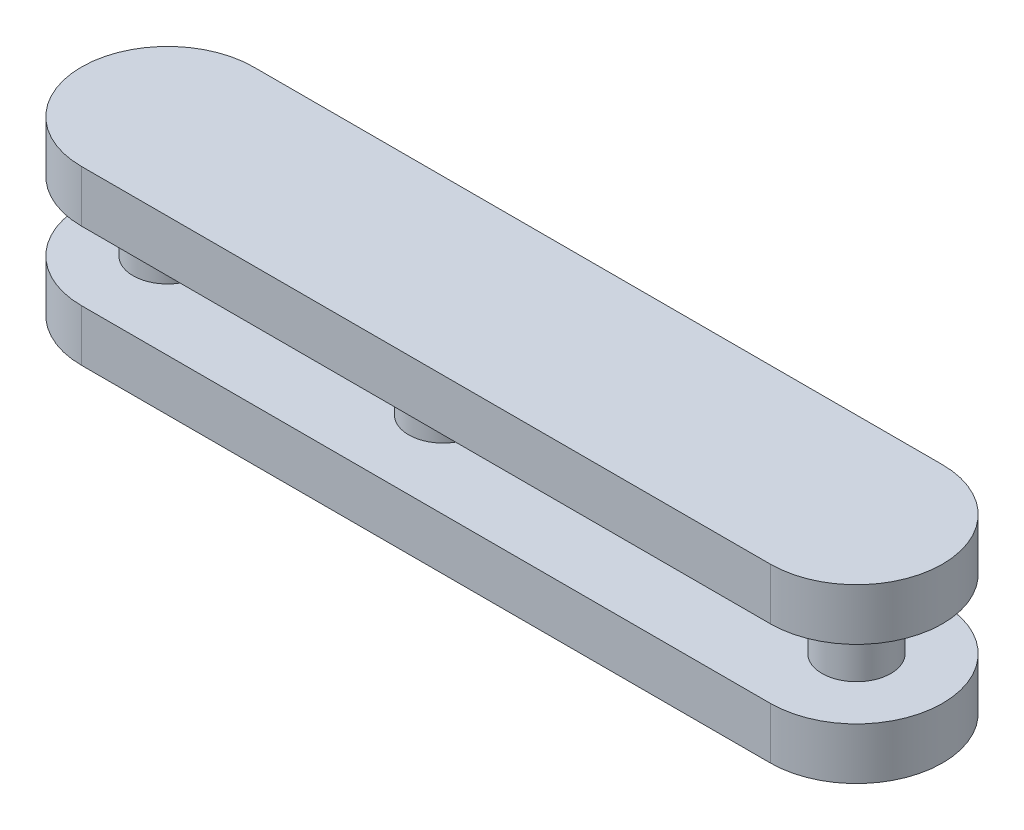
from build123d import *

# Parameters (mm, degrees)
ESQUISSE1_W             = 50
ESQUISSE1_H             = 10
BOSS_EXTRU_1_DEPTH      = 10
ENL_V_MAT_EXTRU_1_DEPTH = 10
ESQUISSE3_R             = 2
BOSS_EXTRU_2_DEPTH      = 5
ENL_V_MAT_EXTRU_2_DEPTH = 52.961524227
ESQUISSE6_R             = 2
BOSS_EXTRU_3_DEPTH      = 5


with BuildPart() as part:
    # Esquisse1 → Boss.-Extru.1 (new body)
    with BuildSketch(Plane(origin=(0, 0, 0), x_dir=(1, 0, 0), z_dir=(0, 1, 0))):
        with Locations((25, 5)):
            Rectangle(ESQUISSE1_W, ESQUISSE1_H)
    extrude(amount=BOSS_EXTRU_1_DEPTH)

    # Esquisse2 → Enlèv. mat.-Extru.1 (cut)
    with BuildSketch(Plane.XY):
        Polygon((0, 3), (20, 3), (30, 3), (50, 3), (50, 7), (30, 7), (20, 7), (0, 7), align=None)
    extrude(amount=-ENL_V_MAT_EXTRU_1_DEPTH, mode=Mode.SUBTRACT)


with BuildPart() as enl_v_mat_extru_1_piece_1:
    # of the separate pieces the step leaves, piece 1, a body of its own (enl_v_mat_extru_1_pieces)
    add(part.part.solids().sort_by_distance((0, 7, 0))[0])

    # Esquisse3 → Boss.-Extru.2 (add)
    with BuildSketch(Plane(origin=(0, 3, 0), x_dir=(1, 0, 0), z_dir=(0, 1, 0))):
        with Locations(Location((5, 5, 0), (0, 0, 270))):
            Circle(ESQUISSE3_R)
        with Locations(Location((45, 5, 0), (0, 0, 270))):
            Circle(ESQUISSE3_R)
    extrude(amount=BOSS_EXTRU_2_DEPTH)


with BuildPart() as enl_v_mat_extru_1_piece_2:
    # of the separate pieces the step leaves, piece 2, a body of its own (enl_v_mat_extru_1_pieces)
    add(part.part.solids().sort_by_distance((0, 0, 0))[0])


with BuildPart() as enl_v_mat_extru_2_tool:
    # Esquisse4 → Enlèv. mat.-Extru.2 (new, through all)
    with BuildSketch(Plane(origin=(0, 10, 0), x_dir=(1, 0, 0), z_dir=(0, 1, 0))):
        with BuildLine():
            Line((5, 0), (-6.304307012, 0))
            Line((-6.304307012, 0), (-6.304307012, 10))
            Line((-6.304307012, 10), (5, 10))
            ThreePointArc((5, 10), (0, 5), (5, 0))
        make_face()
        with BuildLine():
            Line((45, 0), (61.280681511, 0))
            Line((61.280681511, 0), (61.280681511, 10))
            Line((61.280681511, 10), (45, 10))
            ThreePointArc((45, 10), (50, 5), (45, 0))
        make_face()
    extrude(amount=-ENL_V_MAT_EXTRU_2_DEPTH)


with BuildPart() as enl_v_mat_extru_1_piece_1_1:
    add(enl_v_mat_extru_1_piece_1.part)

    # Enlèv. mat.-Extru.2: cut by enl_v_mat_extru_2_tool
    add(enl_v_mat_extru_2_tool.part, mode=Mode.SUBTRACT)



with BuildPart() as enl_v_mat_extru_1_piece_2_1:
    add(enl_v_mat_extru_1_piece_2.part)

    # Enlèv. mat.-Extru.2: cut by enl_v_mat_extru_2_tool
    add(enl_v_mat_extru_2_tool.part, mode=Mode.SUBTRACT)


with BuildPart() as enl_v_mat_extru_1_piece_1_2:
    add(enl_v_mat_extru_1_piece_1_1.part)

    add(enl_v_mat_extru_1_piece_2_1.part)  # Boss.-Extru.3 merges Enlèv. mat.-Extru.1 piece 2
    # Esquisse6 → Boss.-Extru.3 (add)
    with BuildSketch(Plane.XZ.offset(-7)):
        with Locations(Location((21, -5, 0), (0, 0, 90))):
            Circle(ESQUISSE6_R)
    extrude(amount=BOSS_EXTRU_3_DEPTH)


solid = enl_v_mat_extru_1_piece_1_2.part
